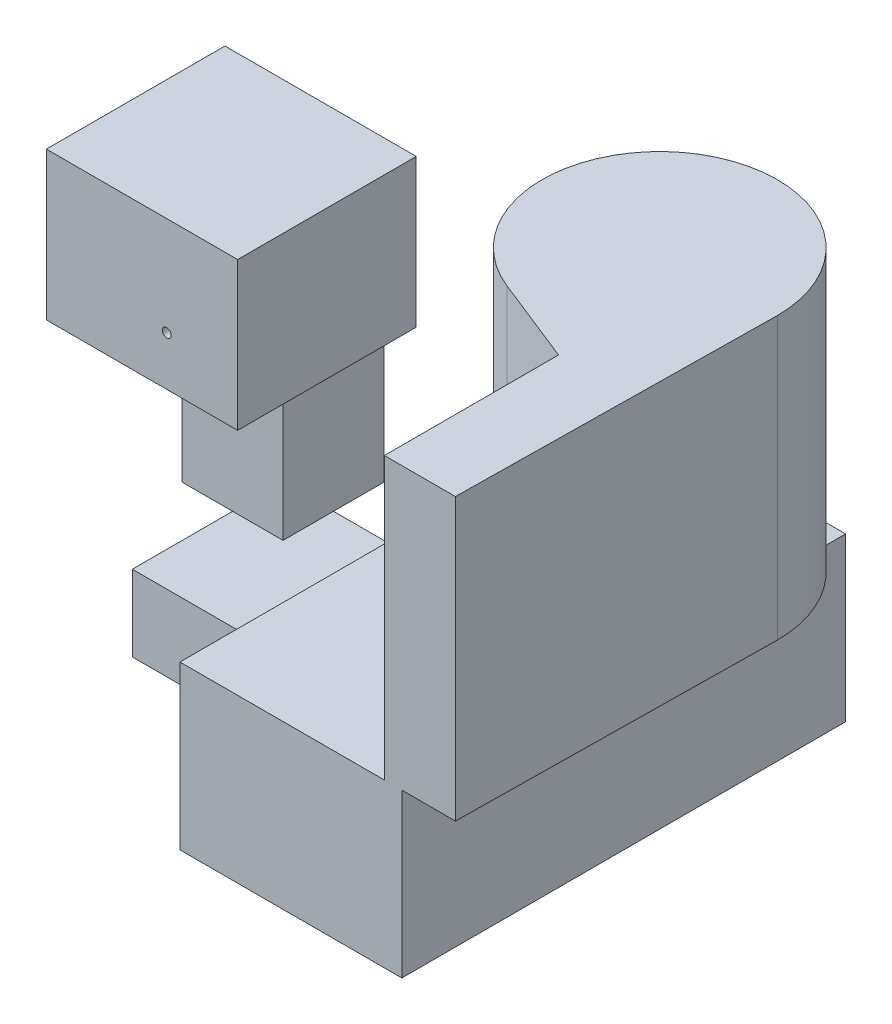
from build123d import *

# Parameters (mm, degrees)
SKETCH1_W           = 150
SKETCH1_H           = 300
BOSS_EXTRUDE1_DEPTH = 110
BOSS_EXTRUDE2_DEPTH = 190
SKETCH3_W           = 101.897148024
SKETCH3_H           = 51.376713289
BOSS_EXTRUDE3_DEPTH = 100
SKETCH4_W           = 68.173568538
SKETCH4_H           = 68.173568538
BOSS_EXTRUDE4_DEPTH = 100
SKETCH5_W           = 129.298061779
SKETCH5_H           = 120.735276231
BOSS_EXTRUDE5_DEPTH = 100
SKETCH6_R           = 3
CUT_EXTRUDE1_DEPTH  = 160


with BuildPart() as part:
    # Sketch1 → Boss-Extrude1 (new body)
    with BuildSketch(Plane(origin=(0, 0, 0), x_dir=(1, 0, 0), z_dir=(0, 1, 0))):
        with Locations((75, 150)):
            Rectangle(SKETCH1_W, SKETCH1_H)
    extrude(amount=-BOSS_EXTRUDE1_DEPTH)

    # Sketch2 → Boss-Extrude2 (add)
    with BuildSketch(Plane(origin=(0, 0, 0), x_dir=(1, 0, 0), z_dir=(0, 1, 0))):
        with BuildLine():
            Line((80.063819978, 140.910835022), (138.200643085, 117.710875285))
            Line((138.200643085, 117.710875285), (138.200643085, 0))
            Line((138.200643085, 0), (186.229076195, 0))
            Line((186.229076195, 0), (189.093435683, 214.792084693))
            ThreePointArc((189.093435683, 214.792084693), (64.923783369, 280.6439946), (80.063819978, 140.910835022))
        make_face()
    extrude(amount=BOSS_EXTRUDE2_DEPTH)

    # Sketch3 → Boss-Extrude3 (add)
    with BuildSketch(Plane.ZY):
        with Locations((-118.745807749, -55.260989225)):
            Rectangle(SKETCH3_W, SKETCH3_H)
    extrude(amount=BOSS_EXTRUDE3_DEPTH)

    # Sketch4 → Boss-Extrude4 (add)
    with BuildSketch(Plane(origin=(0, -29.57263258, 0), x_dir=(1, 0, 0), z_dir=(0, 1, 0))):
        with Locations((-100, 169.694381761)):
            Rectangle(SKETCH4_W, SKETCH4_H)
    extrude(amount=BOSS_EXTRUDE4_DEPTH)

    # Sketch5 → Boss-Extrude5 (add)
    with BuildSketch(Plane(origin=(0, 70.42736742, 0), x_dir=(1, 0, 0), z_dir=(0, 1, 0))):
        with Locations((-110.357521621, 145.07637331)):
            Rectangle(SKETCH5_W, SKETCH5_H)
    extrude(amount=BOSS_EXTRUDE5_DEPTH)

    # Sketch6 → Cut-Extrude1 (cut)
    with BuildSketch(Plane.XY.offset(-84.708735194)):
        with Locations((-93.625898684, 103.612565913)):
            Circle(SKETCH6_R)
    extrude(amount=-CUT_EXTRUDE1_DEPTH, mode=Mode.SUBTRACT)


solid = part.part
